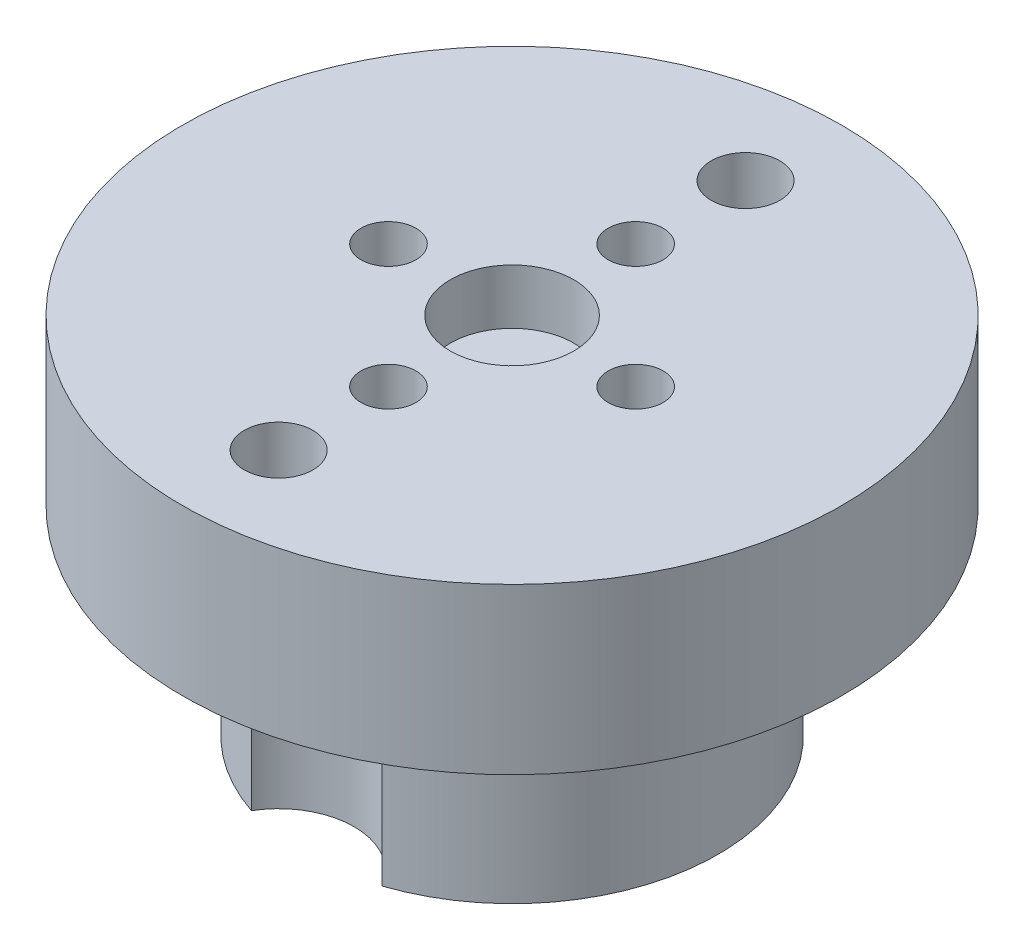
from build123d import *

# Parameters (mm, degrees)
SKETCH2_R          = 1
CUT_EXTRUDE1_DEPTH = 22.53050162
CIRPATTERN1_COUNT  = 4
SKETCH5_R          = 1.25
CUT_EXTRUDE4_DEPTH = 10
SKETCH3_R          = 2.75
CUT_EXTRUDE2_DEPTH = 8
SKETCH4_R          = 2.25
CUT_EXTRUDE3_DEPTH = 2


with BuildPart() as part:
    # Sketch1 → Revolve1 (revolve)
    with BuildSketch(Plane.XY, mode=Mode.PRIVATE) as revolve1_sk:
        Polygon((0, 13.25), (0, 0), (7.5, 0), (7.5, 5.25), (8.5, 5.25), (8.5, 7.25), (12, 7.25), (12, 13.25), align=None)
    revolve(revolve1_sk.sketch.rotate(Axis((0, 0, 0), (0, 1, 0)), 90), axis=Axis((0, 0, 0), (0, 1, 0)))

    # Sketch2 → Cut-Extrude1 (cut, through all)
    with BuildSketch(Plane(origin=(0, 13.25, 0), x_dir=(1, 0, 0), z_dir=(0, 1, 0))):
        with Locations(Location((4.5, 0, 0), (0, 0, 270))):
            Circle(SKETCH2_R)
    cut_extrude1 = extrude(amount=-CUT_EXTRUDE1_DEPTH, mode=Mode.SUBTRACT)

    # CirPattern1: Cut-Extrude1 ×4 about axis
    cirpattern1_axis = Axis((0, 0, 0), (0, 1, 0))
    for i in range(1, CIRPATTERN1_COUNT):
        add(cut_extrude1.rotate(cirpattern1_axis, i * 360 / CIRPATTERN1_COUNT), mode=Mode.SUBTRACT)

    # Sketch5 → Cut-Extrude4 (cut)
    with BuildSketch(Plane(origin=(0, 13.25, 0), x_dir=(1, 0, 0), z_dir=(0, 1, 0))):
        with Locations(Location((0, 8.5, 0), (0, 0, 270))):
            Circle(SKETCH5_R)
        with Locations(Location((0, -8.5, 0), (0, 0, 270))):
            Circle(SKETCH5_R)
    extrude(amount=-CUT_EXTRUDE4_DEPTH, mode=Mode.SUBTRACT)

    # Sketch3 → Cut-Extrude2 (cut)
    with BuildSketch(Plane.XZ):
        with Locations(Location((0, 8.5, 0), (0, 0, 270))):
            Circle(SKETCH3_R)
        with Locations(Location((0, -8.5, 0), (0, 0, 270))):
            Circle(SKETCH3_R)
    extrude(amount=-CUT_EXTRUDE2_DEPTH, mode=Mode.SUBTRACT)

    # Sketch4 → Cut-Extrude3 (cut)
    with BuildSketch(Plane(origin=(0, 13.25, 0), x_dir=(1, 0, 0), z_dir=(0, 1, 0))):
        with Locations(Location((0, 0, 0), (0, 0, 270))):
            Circle(SKETCH4_R)
    extrude(amount=-CUT_EXTRUDE3_DEPTH, mode=Mode.SUBTRACT)


solid = part.part
